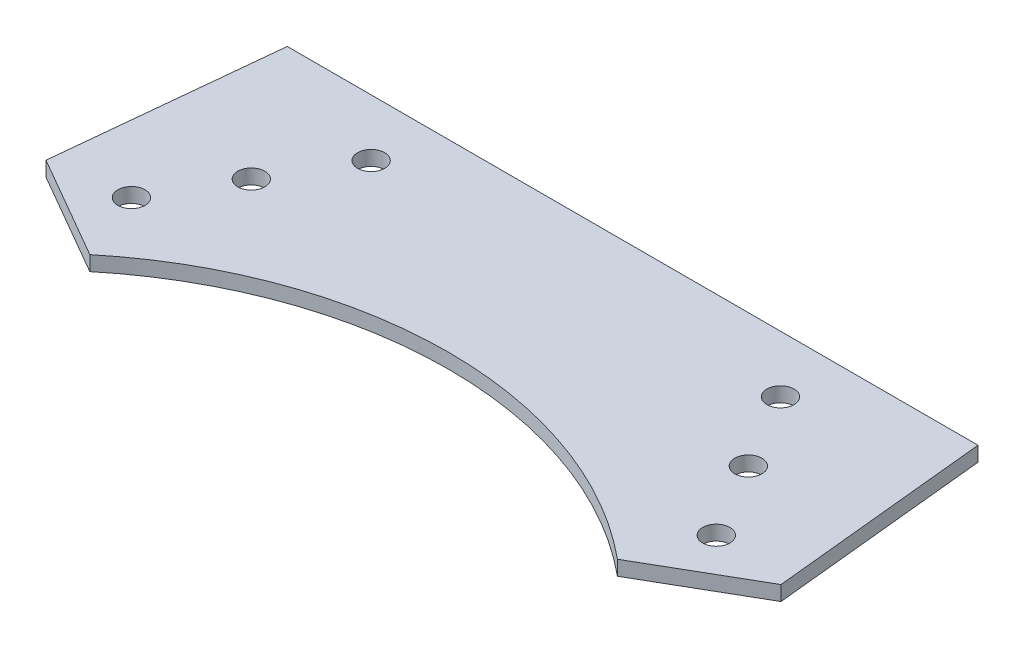
from build123d import *

# Parameters (mm, degrees)
BOSS_EXTRUDE1_DEPTH   = 1.6
F_4_CLEARANCE_HOLE1_D = 2.9464


with BuildPart() as part:
    # Sketch1 → Boss-Extrude1 (new body)
    with BuildSketch(Plane(origin=(0, 0, 0), x_dir=(1, 0, 0), z_dir=(0, 1, 0))):
        with BuildLine():
            Line((-37.5, -32.3215), (37.5, -32.3215))
            Line((37.5, -32.3215), (39.905002751, -56.11749224))
            Line((39.905002751, -56.11749224), (28.646672501, -62.61749224))
            ThreePointArc((28.646672501, -62.61749224), (0, -52.3215), (-28.646672501, -62.61749224))
            Line((-28.646672501, -62.61749224), (-39.905002751, -56.11749224))
            Line((-39.905002751, -56.11749224), (-37.5, -32.3215))
        make_face()
    extrude(amount=BOSS_EXTRUDE1_DEPTH)

    # #4 Clearance Hole1 (through all)
    with Locations(Plane(origin=(0, 1.6, 0), x_dir=(1, 0, 0), z_dir=(0, 1, 0))):
        with Locations((22.225, -38.494829198), (26.9875, -46.743721169), (31.75, -54.99261314)):
            f_4_clearance_hole1 = Hole(F_4_CLEARANCE_HOLE1_D / 2)

    # Mirror1: #4 Clearance Hole1 across plane
    add(f_4_clearance_hole1.mirror(Plane(origin=(0, 0, 0), x_dir=(0, 0, 1), z_dir=(1, 0, 0))), mode=Mode.SUBTRACT)


solid = part.part
